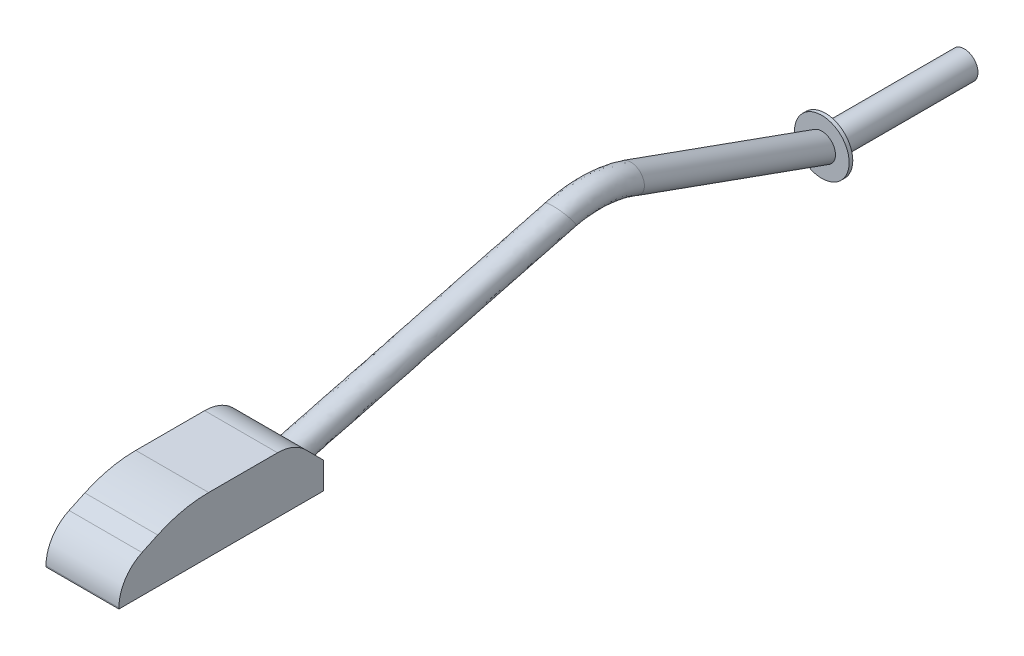
from build123d import *

# Parameters (mm, degrees)
CROQUIS1_R                   = 75
SALIENTE_EXTRUIR1_DEPTH      = 10
CROQUIS2_R                   = 37.5
CROQUIS4_R                   = 37.5
SALIENTE_EXTRUIR3_DEPTH      = 381
SALIENTE_EXTRUIR4_DEPTH      = 100
SALIENTE_EXTRUIR4_DEPTH_BACK = 100
CROQUIS6_W                   = 141.368041576
CROQUIS6_H                   = 480.917106318
CORTAR_EXTRUIR1_DEPTH        = 20


with BuildPart() as part:
    # Croquis1 → Saliente-Extruir1 (new body)
    with BuildSketch(Plane.XY):
        Circle(CROQUIS1_R)
    extrude(amount=SALIENTE_EXTRUIR1_DEPTH)

    # Barrer2: sweep along a curve in space
    with BuildLine() as barrer2_path:
        Line((0, 0, 0), (0, 192.014551033, 534.190633363))
        ThreePointArc((0, 192.014551033, 534.190633363), (0, 211.131156127, 630.926630457), (0, 200.813232001, 728.992109428))
        Line((0, 200.813232001, 728.992109428), (0, 0, 1500))
    # Croquis2 → Barrer2 (sweep)
    with BuildSketch(Plane.XY.offset(10)):
        Circle(CROQUIS2_R)
    sweep(path=barrer2_path.line)

    # Croquis4 → Saliente-Extruir3 (add)
    with BuildSketch(Plane(origin=(0, 0, 0), x_dir=(-1, 0, 0), z_dir=(0, 0, -1))):
        Circle(CROQUIS4_R)
    extrude(amount=SALIENTE_EXTRUIR3_DEPTH)

    # Croquis5 → Saliente-Extruir4 (add, two sides: drawn at the far end of the back side and taken through both)
    with BuildSketch(Plane(origin=(0, 0, 0), x_dir=(0, 0, -1), z_dir=(1, 0, 0)).offset(-SALIENTE_EXTRUIR4_DEPTH_BACK)):
        with BuildLine():
            Line((-1476.800956395, -33.919933481), (-1476.800956395, 39.013652266))
            Line((-1476.800956395, 39.013652266), (-1525.449183366, 87.661879237))
            ThreePointArc((-1525.449183366, 87.661879237), (-1561.135751737, 111.506881882), (-1603.230929297, 119.880133306))
            Line((-1603.230929297, 119.880133306), (-1792.167323705, 119.880133306))
            ThreePointArc((-1792.167323705, 119.880133306), (-1863.764639403, 112.019581969), (-1931.951080097, 88.812402305))
            Line((-1931.951080097, 88.812402305), (-1975.041969043, 68.662666235))
            ThreePointArc((-1975.041969043, 68.662666235), (-2021.25202894, 28.071923633), (-2038.447383579, -30.981423431))
            Line((-2038.447383579, -30.981423431), (-2038.447383579, -33.919933481))
            Line((-2038.447383579, -33.919933481), (-1476.800956395, -33.919933481))
        make_face()
    extrude(amount=SALIENTE_EXTRUIR4_DEPTH + SALIENTE_EXTRUIR4_DEPTH_BACK)

    # Croquis6 → Cortar-Extruir1 (cut)
    with BuildSketch(Plane.XZ.offset(33.919933481)):
        with Locations((0, 1764.64048311)):
            Rectangle(CROQUIS6_W, CROQUIS6_H)
    extrude(amount=-CORTAR_EXTRUIR1_DEPTH, mode=Mode.SUBTRACT)


solid = part.part
